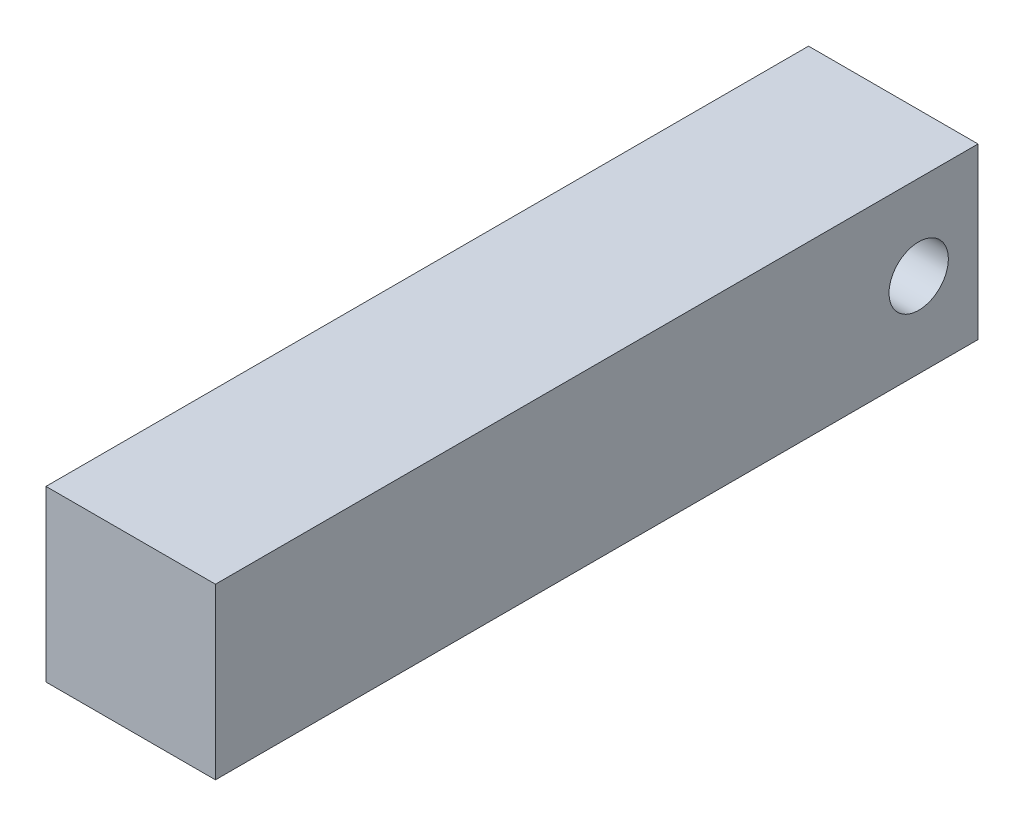
from build123d import *

# Parameters (mm, degrees)
SKETCH_1_W          = 10
SKETCH_1_H          = 10
EXTRUDE_1_DEPTH     = 45
SKETCH_2_W          = 3
SKETCH_2_H          = 5
CUT_EXTRUDE_1_DEPTH = 7
CUT_EXTRUDE_2_REACH = 49.17
SKETCH_3_R          = 1.75


with BuildPart() as part:
    # 草图1 → 凸台-拉伸1 (new body)
    with BuildSketch(Plane.XY):
        with Locations((5, -5)):
            Rectangle(SKETCH_1_W, SKETCH_1_H)
    extrude(amount=EXTRUDE_1_DEPTH)

    # 草图2 → 切除-拉伸1 (cut)
    with BuildSketch(Plane(origin=(0, 0, 0), x_dir=(-1, 0, 0), z_dir=(0, 0, -1))):
        with Locations((-5, -5)):
            Rectangle(SKETCH_2_W, SKETCH_2_H)
    extrude(amount=-CUT_EXTRUDE_1_DEPTH, mode=Mode.SUBTRACT)

    # 草图3 → 切除-拉伸2 (cut, up to next)
    with BuildSketch(Plane(origin=(10, 0, 0), x_dir=(0, 0, -1), z_dir=(1, 0, 0)), mode=Mode.PRIVATE) as cut_extrude_2_sk1:
        with Locations(Location((-3.5, -5, 0), (0, 0, 90))):
            Circle(SKETCH_3_R)
    cut_extrude_2_tool1 = extrude(cut_extrude_2_sk1.sketch, amount=-CUT_EXTRUDE_2_REACH, mode=Mode.PRIVATE) & part.part
    add(cut_extrude_2_tool1.solids().sort_by_distance((10, -5, 3.5))[0], mode=Mode.SUBTRACT)


solid = part.part
